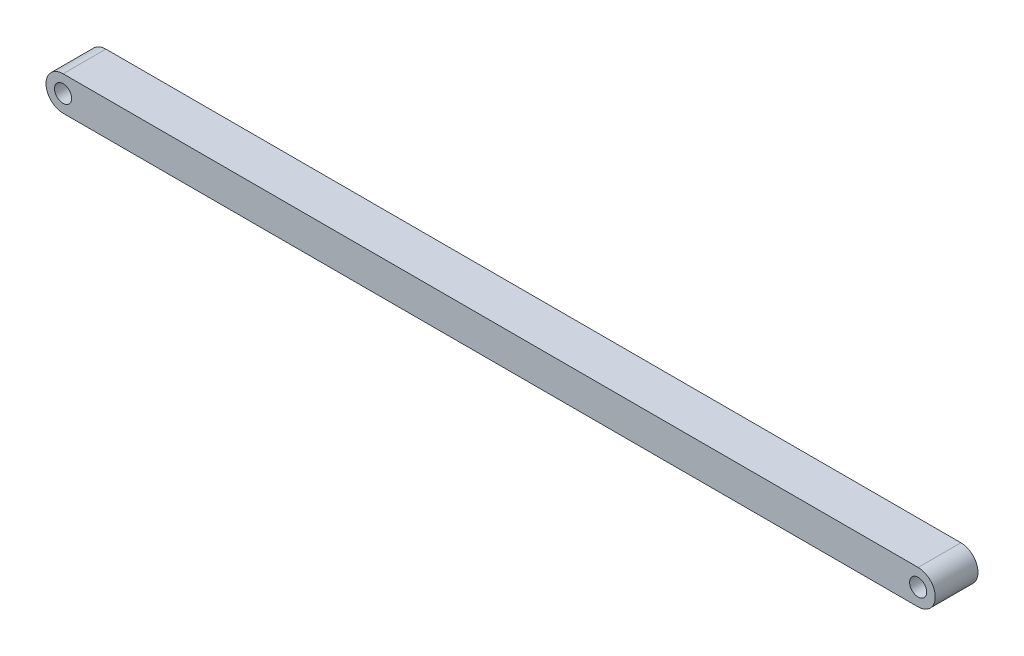
from build123d import *

# Parameters (mm, degrees)
SKETCH1_R           = 1
BOSS_EXTRUDE1_DEPTH = 5


with BuildPart() as part:
    # Sketch1 → Boss-Extrude1 (new body)
    with BuildSketch(Plane.XY):
        with BuildLine():
            Line((0, 2), (100, 2))
            ThreePointArc((100, 2), (102, 0), (100, -2))
            Line((100, -2), (0, -2))
            ThreePointArc((0, -2), (-2, 0), (0, 2))
        make_face()
        Circle(SKETCH1_R, mode=Mode.SUBTRACT)
        with Locations((100, 0)):
            Circle(SKETCH1_R, mode=Mode.SUBTRACT)
    extrude(amount=BOSS_EXTRUDE1_DEPTH)


solid = part.part
